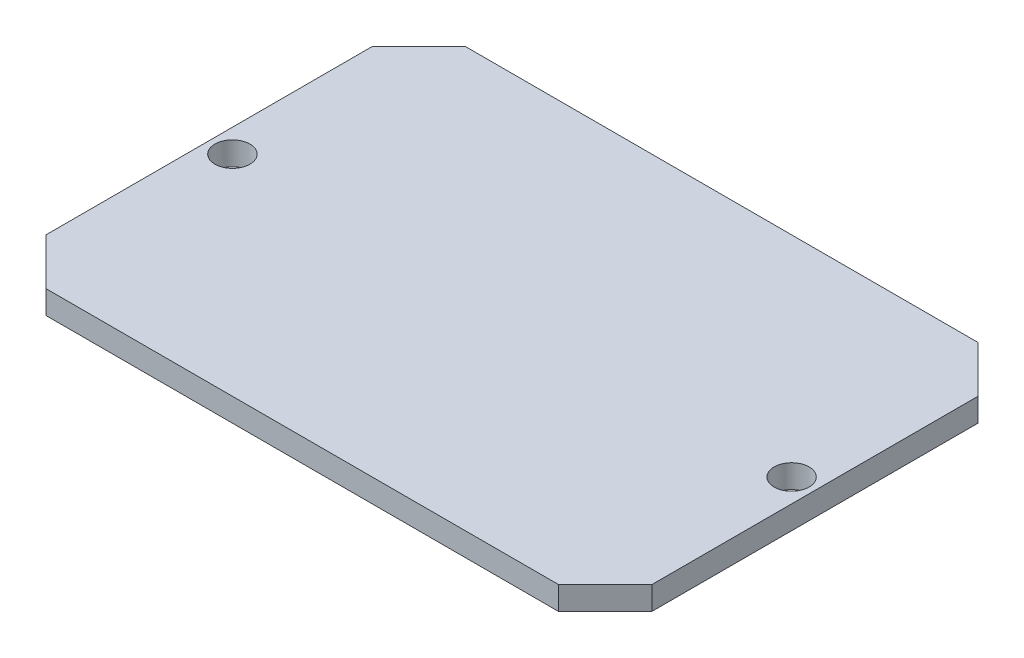
from build123d import *

# Parameters (mm, degrees)
SKETCH1_R      = 2.38252
EXTRUDE1_DEPTH = 3.175
EXTRUDE2_DEPTH = 3.175
CHAMFER1_SIZE  = 6.35


with BuildPart() as part:
    # Sketch1 → Extrude1 (new body)
    with BuildSketch(Plane(origin=(0, 0, 0), x_dir=(1, 0, 0), z_dir=(0, 1, 0))):
        with BuildLine():
            Line((-31.75, 28.575), (31.75, 28.575))
            ThreePointArc((31.75, 28.575), (38.485192091, 25.785192091), (41.275, 19.05))
            Line((41.275, 19.05), (41.275, -19.05))
            ThreePointArc((41.275, -19.05), (38.485192091, -25.785192091), (31.75, -28.575))
            Line((31.75, -28.575), (-31.75, -28.575))
            ThreePointArc((-31.75, -28.575), (-38.485192091, -25.785192091), (-41.275, -19.05))
            Line((-41.275, -19.05), (-41.275, 19.05))
            ThreePointArc((-41.275, 19.05), (-38.485192091, 25.785192091), (-31.75, 28.575))
        make_face()
        with Locations(Location((38.1, 0, 0), (0, 0, 270))):
            Circle(SKETCH1_R, mode=Mode.SUBTRACT)
        with Locations(Location((-38.1, 0, 0), (0, 0, 90))):
            Circle(SKETCH1_R, mode=Mode.SUBTRACT)
    extrude(amount=EXTRUDE1_DEPTH)

    # Sketch2 → Extrude2 (add)
    with BuildSketch(Plane(origin=(0, 0, 0), x_dir=(1, 0, 0), z_dir=(0, 1, 0))):
        Polygon((31.75, 28.575), (41.275, 19.05), (41.275, 28.575), align=None)
        Polygon((-31.75, 28.575), (-41.275, 19.05), (-41.275, 28.575), align=None)
        Polygon((-41.275, -19.05), (-31.75, -28.575), (-41.275, -28.575), align=None)
        Polygon((41.275, -19.05), (31.75, -28.575), (41.275, -28.575), align=None)
    extrude(amount=EXTRUDE2_DEPTH)

    # Chamfer1
    chamfer1_edges = [part.edges().sort_by_distance(p)[0] for p in [
        (41.275, 1.5875, -28.575),
        (-41.275, 1.5875, -28.575),
        (-41.275, 1.5875, 28.575),
        (41.275, 1.5875, 28.575),
    ]]
    chamfer(chamfer1_edges, length=CHAMFER1_SIZE)


solid = part.part
